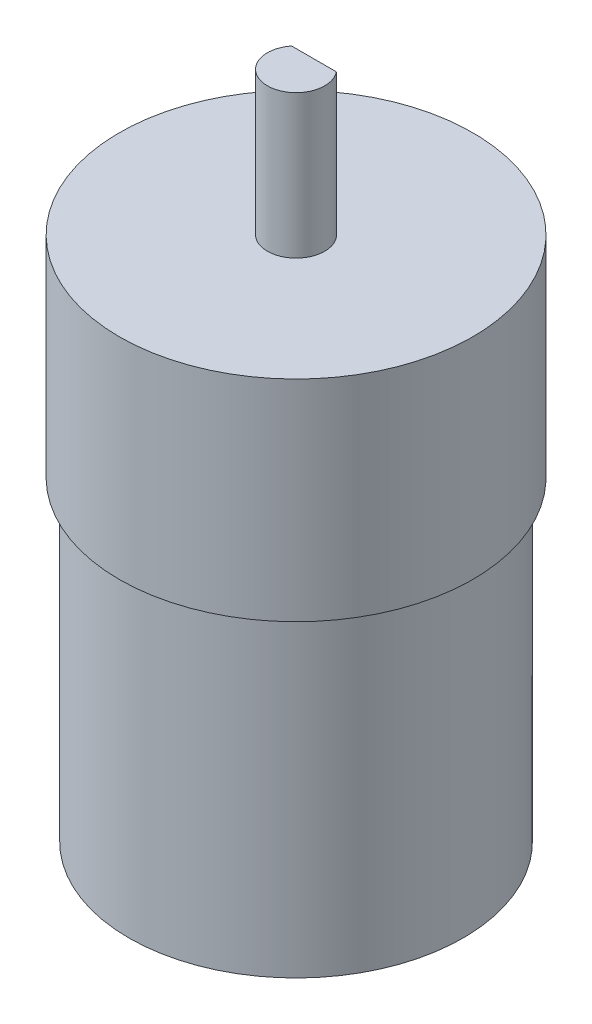
from build123d import *

# Parameters (mm, degrees)
SKETCH_1_R      = 17.5
EXTRUDE_1_DEPTH = 33
SKETCH_2_R      = 18.5
EXTRUDE_2_DEPTH = 22
EXTRUDE_3_DEPTH = 15


with BuildPart() as part:
    # 草图1 → 凸台-拉伸1 (new body)
    with BuildSketch(Plane(origin=(0, 0, 0), x_dir=(1, 0, 0), z_dir=(0, 1, 0))):
        with Locations(Location((0, 0, 0), (0, 0, 270))):
            Circle(SKETCH_1_R)
    extrude(amount=EXTRUDE_1_DEPTH)

    # 草图2 → 凸台-拉伸2 (add)
    with BuildSketch(Plane(origin=(0, 33, 0), x_dir=(1, 0, 0), z_dir=(0, 1, 0))):
        with Locations(Location((0, 0, 0), (0, 0, 270))):
            Circle(SKETCH_2_R)
    extrude(amount=EXTRUDE_2_DEPTH)

    # 草图3 → 凸台-拉伸3 (add)
    with BuildSketch(Plane(origin=(0, 55, 0), x_dir=(1, 0, 0), z_dir=(0, 1, 0))):
        with BuildLine():
            Line((2.339523617, 1.877932173), (0, 1.877932173))
            Line((0, 1.877932173), (-2.339523617, 1.877932173))
            ThreePointArc((-2.339523617, 1.877932173), (-0.99534646, -2.830068095), (3, 0))
            ThreePointArc((3, 0), (2.830068095, 0.99534646), (2.339523617, 1.877932173))
        make_face()
    extrude(amount=EXTRUDE_3_DEPTH)


solid = part.part
